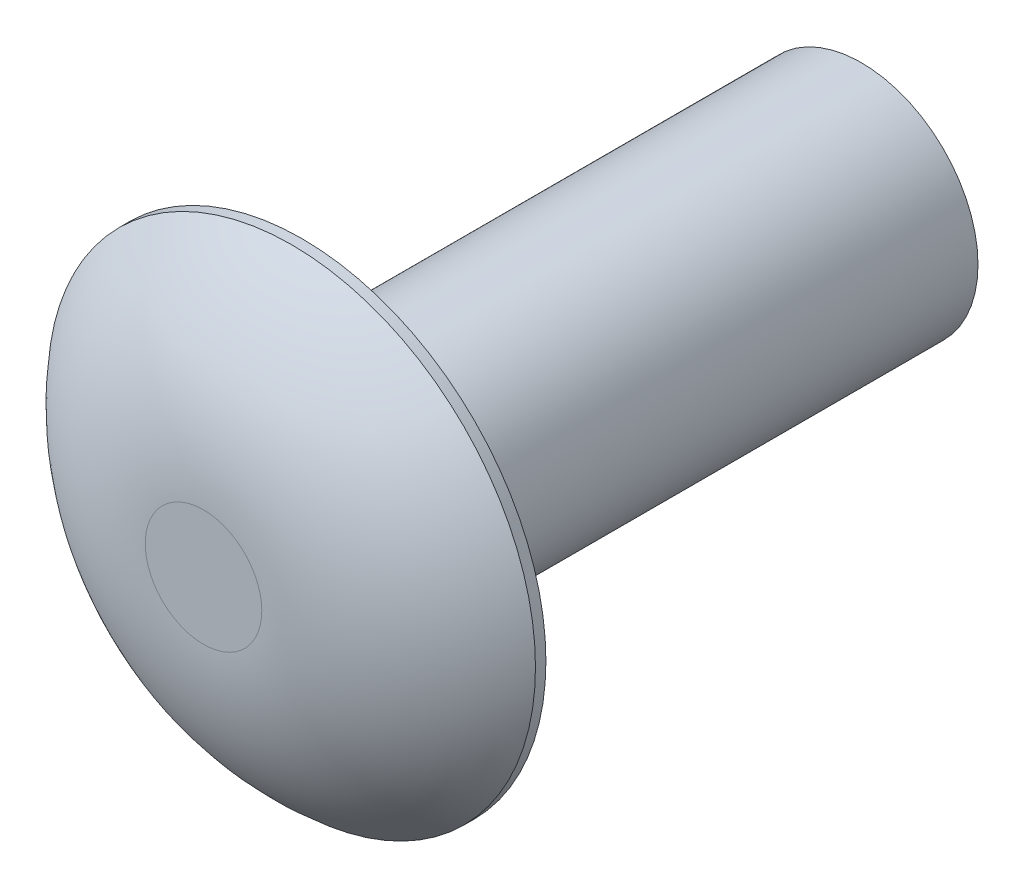
from build123d import *

# Parameters (mm, degrees)
CUT_EXTRUDE1_DEPTH      = 22.542442188
CUT_EXTRUDE1_DEPTH_BACK = 22.542442188
CUT_EXTRUDE2_DEPTH      = 22.542442188
CUT_EXTRUDE2_DEPTH_BACK = 22.542442188
FILLET2_R               = 0.254
LPATTERN1_COUNT         = 18
LPATTERN1_PITCH         = 0.762
CUT_EXTRUDE3_DEPTH      = 22.542442285
CUT_EXTRUDE3_DEPTH_BACK = 22.542442285
SKETCH7_W               = 2.637927388
SKETCH7_H               = 20.320175892


with BuildPart() as part:
    # Sketch2 → Revolve1 (revolve)
    with BuildSketch(Plane(origin=(0, 0, 0), x_dir=(0, 0, -1), z_dir=(1, 0, 0)), mode=Mode.PRIVATE) as revolve1_sk:
        with BuildLine():
            Line((-20.7264, 0), (-20.7264, 0.9921875))
            Line((-20.7264, 0.9921875), (-1.6764, 0.9921875))
            ThreePointArc((-1.6764, 0.9921875), (-1.282773396, 2.741180458), (-0.1778, 4.1529))
            Line((-0.1778, 4.1529), (0, 4.1529))
            Line((0, 4.1529), (0, 1.984375))
            Line((0, 1.984375), (9.525, 1.984375))
            Line((9.525, 1.984375), (9.525, 1.870886692))
            Line((9.525, 1.870886692), (9.525, 0))
            Line((9.525, 0), (-20.7264, 0))
        make_face()
    revolve(revolve1_sk.sketch.rotate(Axis((0, 0, 20.7264), (0, 0, -1)), 90), axis=Axis((0, 0, 20.7264), (0, 0, -1)))

    # Sketch3 → Cut-Extrude1 (cut, two sides: drawn at the far end of the back side and taken through both)
    with BuildSketch(Plane(origin=(0, 0, 0), x_dir=(1, 0, 0), z_dir=(0, 1, 0)).offset(-CUT_EXTRUDE1_DEPTH_BACK)):
        Polygon((0, -20.7264), (1.1953875, -19.16854068), (1.1953875, -21.2344), (-1.1953875, -21.2344), (-1.1953875, -19.16854068), align=None)
    extrude(amount=CUT_EXTRUDE1_DEPTH + CUT_EXTRUDE1_DEPTH_BACK, mode=Mode.SUBTRACT)

    # Sketch5 → Cut-Extrude2 (cut, two sides: drawn at the far end of the back side and taken through both)
    with BuildSketch(Plane(origin=(0, 0, 0), x_dir=(0, 0, -1), z_dir=(1, 0, 0)).offset(-CUT_EXTRUDE2_DEPTH_BACK)):
        Polygon((-20.7264, 0), (-19.433356075, 1.3096875), (-21.0439, 1.3096875), (-21.0439, -1.3096875), (-19.433356075, -1.3096875), align=None)
    extrude(amount=CUT_EXTRUDE2_DEPTH + CUT_EXTRUDE2_DEPTH_BACK, mode=Mode.SUBTRACT)

    # Fillet2
    fillet2_edges = [part.edges().sort_by_distance(p)[0] for p in [
        (-1.984375, 0, 0),
    ]]
    fillet(fillet2_edges, radius=FILLET2_R)

    # Sketch6 → Cut-Revolve1 (revolve, cut)
    with BuildSketch(Plane(origin=(0, 0, 0), x_dir=(0, 0, -1), z_dir=(1, 0, 0)), mode=Mode.PRIVATE) as cut_revolve1_sk:
        with BuildLine():
            Line((-6.5913, 0.9921875), (-6.4389, 0.9921875))
            ThreePointArc((-6.4389, 0.9921875), (-6.5151, 0.9159875), (-6.5913, 0.9921875))
        make_face()
    cut_revolve1 = revolve(cut_revolve1_sk.sketch.rotate(Axis((0, 0, 20.7264), (0, 0, -1)), 90), axis=Axis((0, 0, 20.7264), (0, 0, -1)), mode=Mode.SUBTRACT)

    # LPattern1: Cut-Revolve1 ×18
    with Locations(*[(0, 0, i * LPATTERN1_PITCH) for i in range(1, LPATTERN1_COUNT)]):
        add(cut_revolve1, mode=Mode.SUBTRACT)

    # Sketch7 → Cut-Extrude3 (cut, two sides: drawn at the far end of the back side and taken through both)
    with BuildSketch(Plane(origin=(0, 0, 0), x_dir=(1, 0, 0), z_dir=(0, 1, 0)).offset(-CUT_EXTRUDE3_DEPTH_BACK)):
        with Locations((0.326776194, -11.836487946)):
            Rectangle(SKETCH7_W, SKETCH7_H)
    extrude(amount=CUT_EXTRUDE3_DEPTH + CUT_EXTRUDE3_DEPTH_BACK, mode=Mode.SUBTRACT)


solid = part.part
